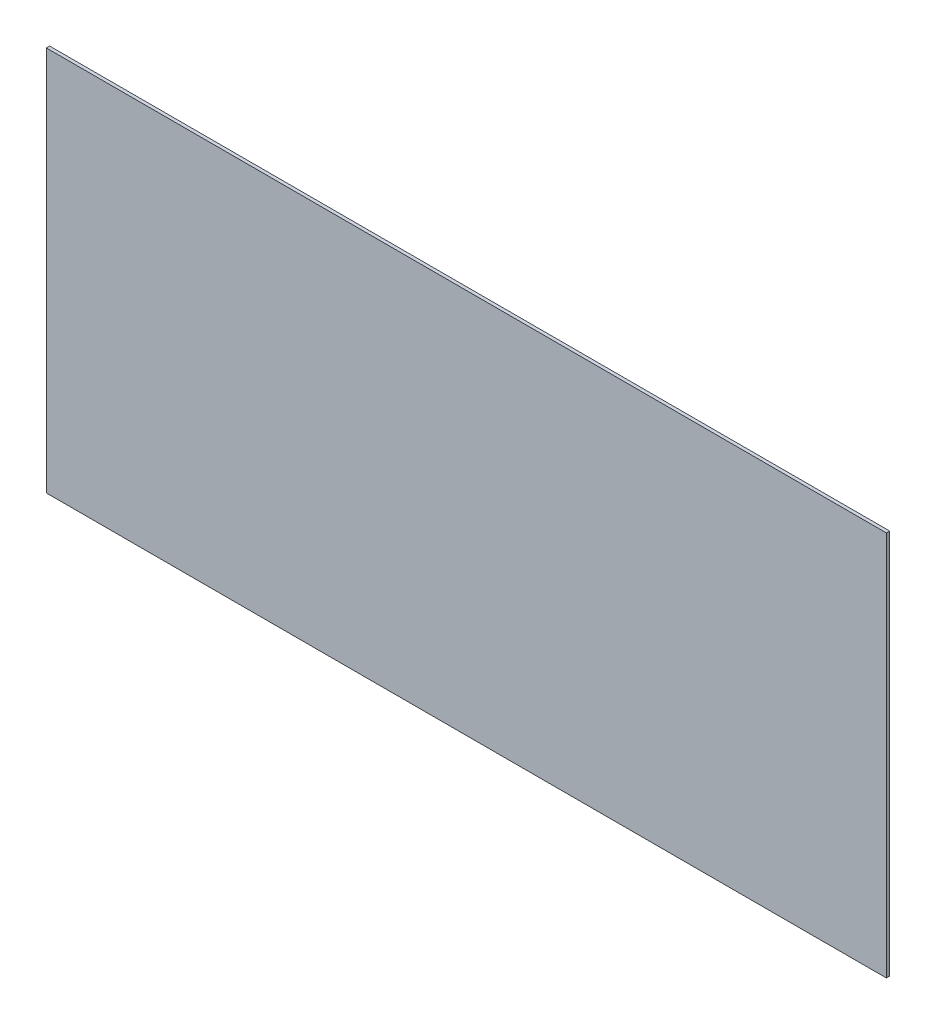
from build123d import *

# Parameters (mm, degrees)
SKETCH_3_W      = 1020
SKETCH_3_H      = 468
EXTRUDE_1_DEPTH = 4


with BuildPart() as part:
    # 草图3 → 凸台-拉伸1 (new body)
    with BuildSketch(Plane.XY):
        with Locations((1171.607818449, 667.696034701)):
            Rectangle(SKETCH_3_W, SKETCH_3_H)
    extrude(amount=EXTRUDE_1_DEPTH)


solid = part.part
